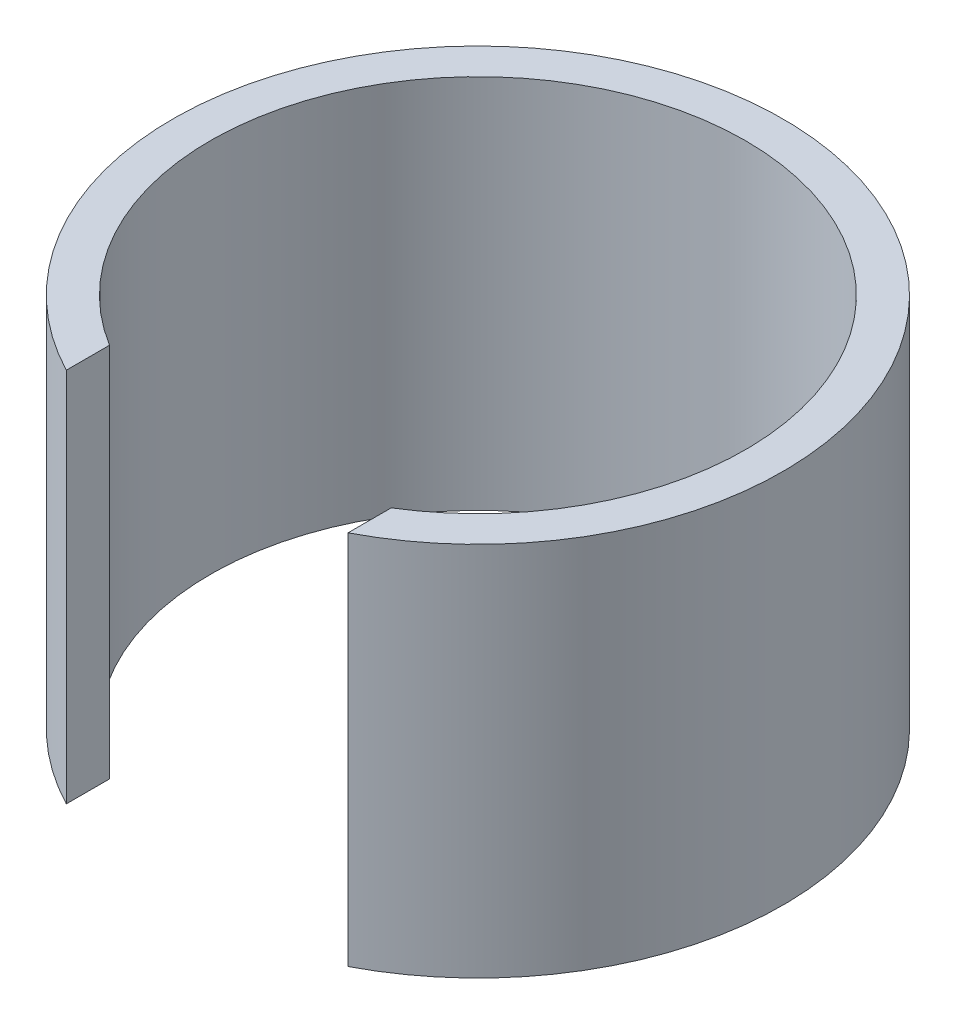
from build123d import *

# Parameters (mm, degrees)
ESBO_O2_R                = 32.5
RESSALTO_EXTRUS_O1_DEPTH = 40
ESBO_O3_R                = 28.5
CORTE_EXTRUS_O1_DEPTH    = 40
ESBO_O4_W                = 30
ESBO_O4_H                = 19.489170569
CORTE_EXTRUS_O2_DEPTH    = 61.930288035


with BuildPart() as part:
    # Esboço2 → Ressalto-extrusão1 (new body)
    with BuildSketch(Plane(origin=(0, 0, 0), x_dir=(1, 0, 0), z_dir=(0, 1, 0))):
        with Locations(Location((0, 0, 0), (0, 0, 270))):
            Circle(ESBO_O2_R)
    extrude(amount=RESSALTO_EXTRUS_O1_DEPTH)

    # Esboço3 → Corte-extrusão1 (cut)
    with BuildSketch(Plane(origin=(0, 40, 0), x_dir=(1, 0, 0), z_dir=(0, 1, 0))):
        with Locations(Location((0, 0, 0), (0, 0, 270))):
            Circle(ESBO_O3_R)
    extrude(amount=-CORTE_EXTRUS_O1_DEPTH, mode=Mode.SUBTRACT)

    # Esboço4 → Corte-extrusão2 (cut, through all)
    with BuildSketch(Plane(origin=(0, 0, 0), x_dir=(1, 0, 0), z_dir=(0, 1, 0))):
        with Locations((0, -26.797609532)):
            Rectangle(ESBO_O4_W, ESBO_O4_H)
    extrude(amount=CORTE_EXTRUS_O2_DEPTH, mode=Mode.SUBTRACT)


solid = part.part
